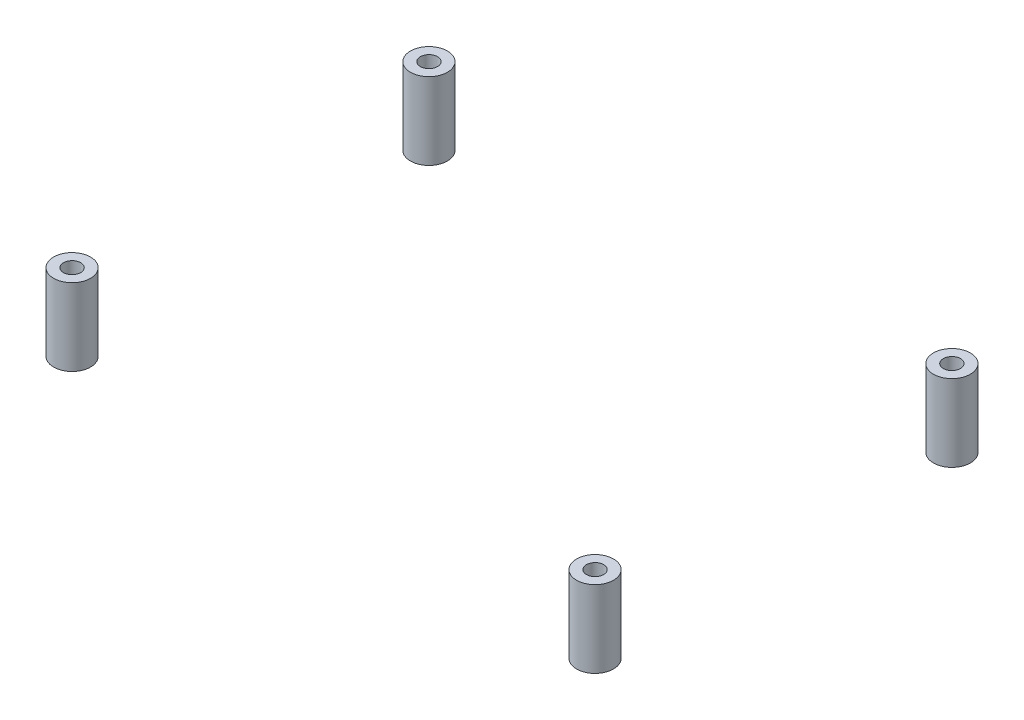
from build123d import *

# Parameters (mm, degrees)
BOSS_EXTRUDE1_DEPTH = 12.5
SKETCH2_R           = 1.4
CUT_EXTRUDE1_DEPTH  = 10


with BuildPart() as part:
    # Sketch1 → Boss-Extrude1 (new body)
    with BuildSketch(Plane(origin=(0, 0, 0), x_dir=(1, 0, 0), z_dir=(0, 1, 0))):
        with BuildLine():
            ThreePointArc((-17.207199178, -35.584421134), (-18.085878834, -33.46310079), (-20.207199178, -32.584421134))
            Line((-20.207199178, -32.584421134), (-20.207199178, -35.584421134))
            Line((-20.207199178, -35.584421134), (-17.207199178, -35.584421134))
        make_face()
        with BuildLine():
            Line((-20.207199178, -35.584421134), (-20.207199178, -32.584421134))
            ThreePointArc((-20.207199178, -32.584421134), (-22.328519521, -37.705741477), (-17.207199178, -35.584421134))
            Line((-17.207199178, -35.584421134), (-20.207199178, -35.584421134))
        make_face()
        with BuildLine():
            Line((-20.207199178, 19.415578866), (-20.207199178, 22.415578866))
            Line((-20.207199178, 22.415578866), (-17.207199178, 22.415578866))
            ThreePointArc((-17.207199178, 22.415578866), (-22.328519521, 24.53689921), (-20.207199178, 19.415578866))
        make_face()
        with BuildLine():
            Line((-17.207199178, 22.415578866), (-20.207199178, 22.415578866))
            Line((-20.207199178, 22.415578866), (-20.207199178, 19.415578866))
            ThreePointArc((-20.207199178, 19.415578866), (-18.085878834, 20.294258523), (-17.207199178, 22.415578866))
        make_face()
        with BuildLine():
            ThreePointArc((67.792800822, -35.584421134), (66.914121166, -33.46310079), (64.792800822, -32.584421134))
            Line((64.792800822, -32.584421134), (64.792800822, -35.584421134))
            Line((64.792800822, -35.584421134), (61.792800822, -35.584421134))
            ThreePointArc((61.792800822, -35.584421134), (64.792800822, -38.584421134), (67.792800822, -35.584421134))
        make_face()
        with BuildLine():
            Line((64.792800822, -35.584421134), (64.792800822, -32.584421134))
            ThreePointArc((64.792800822, -32.584421134), (62.671480479, -33.46310079), (61.792800822, -35.584421134))
            Line((61.792800822, -35.584421134), (64.792800822, -35.584421134))
        make_face()
        with BuildLine():
            ThreePointArc((67.792800822, 22.415578866), (64.792800822, 25.415578866), (61.792800822, 22.415578866))
            Line((61.792800822, 22.415578866), (64.792800822, 22.415578866))
            Line((64.792800822, 22.415578866), (64.792800822, 19.415578866))
            ThreePointArc((64.792800822, 19.415578866), (66.914121166, 20.294258523), (67.792800822, 22.415578866))
        make_face()
        with BuildLine():
            Line((64.792800822, 22.415578866), (61.792800822, 22.415578866))
            ThreePointArc((61.792800822, 22.415578866), (62.671480479, 20.294258523), (64.792800822, 19.415578866))
            Line((64.792800822, 19.415578866), (64.792800822, 22.415578866))
        make_face()
    extrude(amount=BOSS_EXTRUDE1_DEPTH)

    # Sketch2 → Cut-Extrude1 (cut)
    with BuildSketch(Plane(origin=(0, 12.5, 0), x_dir=(1, 0, 0), z_dir=(0, 1, 0))):
        with Locations(Location((-20.207199178, 22.415578866, 0), (0, 0, 270))):
            Circle(SKETCH2_R)
        with Locations(Location((-20.207199178, -35.584421134, 0), (0, 0, 270))):
            Circle(SKETCH2_R)
        with Locations(Location((64.792800822, -35.584421134, 0), (0, 0, 270))):
            Circle(SKETCH2_R)
        with Locations(Location((64.792800822, 22.415578866, 0), (0, 0, 270))):
            Circle(SKETCH2_R)
    extrude(amount=-CUT_EXTRUDE1_DEPTH, mode=Mode.SUBTRACT)


solid = part.part
